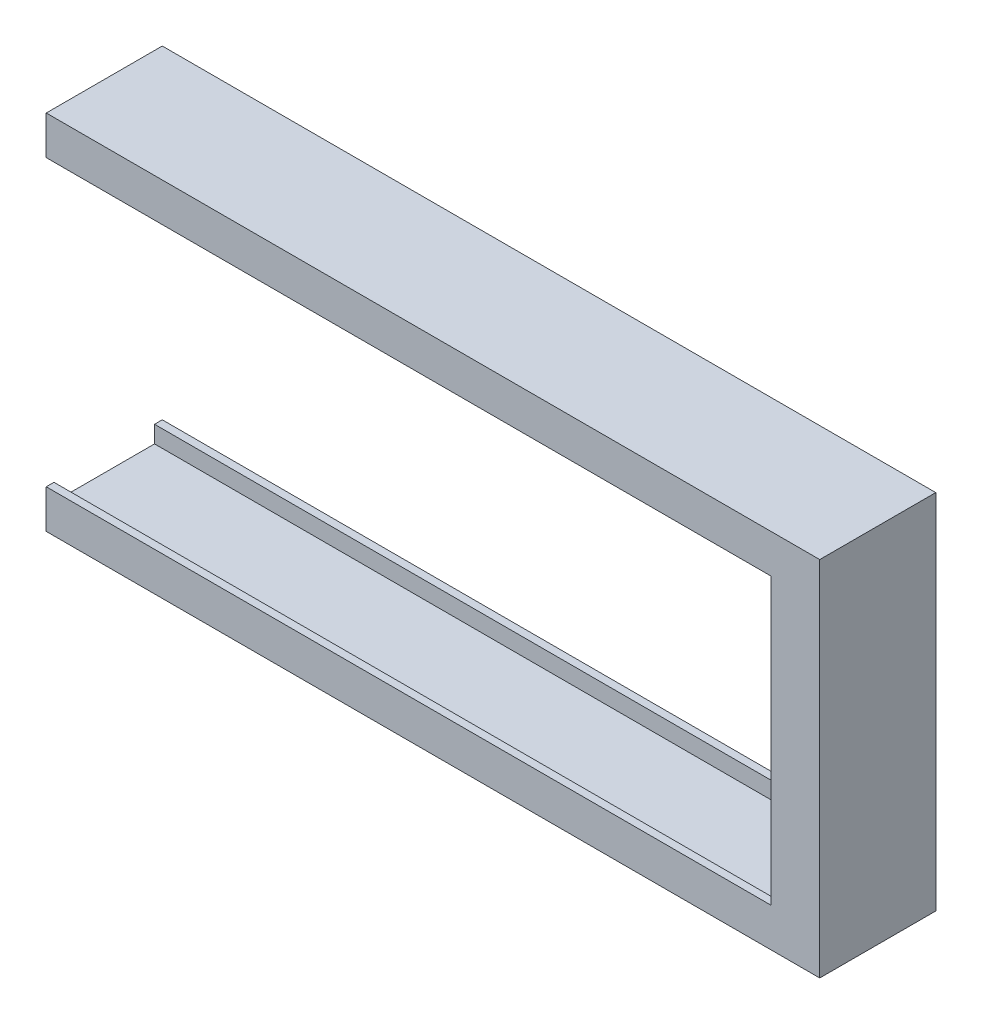
from build123d import *

# Parameters (mm, degrees)
SKETCH1_W           = 254
SKETCH1_H           = 118.999
BOSS_EXTRUDE1_DEPTH = 38.1
SKETCH2_W           = 33.02
SKETCH2_H           = 104.775
CUT_EXTRUDE1_DEPTH  = 241.3
SKETCH5_W           = 238.017311759
SKETCH5_H           = 93.599
CUT_EXTRUDE2_DEPTH  = 38.354


with BuildPart() as part:
    # Sketch1 → Boss-Extrude1 (new body)
    with BuildSketch(Plane.XY):
        Rectangle(SKETCH1_W, SKETCH1_H)
    extrude(amount=-BOSS_EXTRUDE1_DEPTH)

    # Sketch2 → Cut-Extrude1 (cut)
    with BuildSketch(Plane.ZY.offset(127)):
        with Locations((-19.05, 0)):
            Rectangle(SKETCH2_W, SKETCH2_H)
    extrude(amount=-CUT_EXTRUDE1_DEPTH, mode=Mode.SUBTRACT)

    # Sketch5 → Cut-Extrude2 (cut)
    with BuildSketch(Plane.XY):
        with Locations((-7.991344121, 0)):
            Rectangle(SKETCH5_W, SKETCH5_H)
    extrude(amount=-CUT_EXTRUDE2_DEPTH, mode=Mode.SUBTRACT)


solid = part.part
